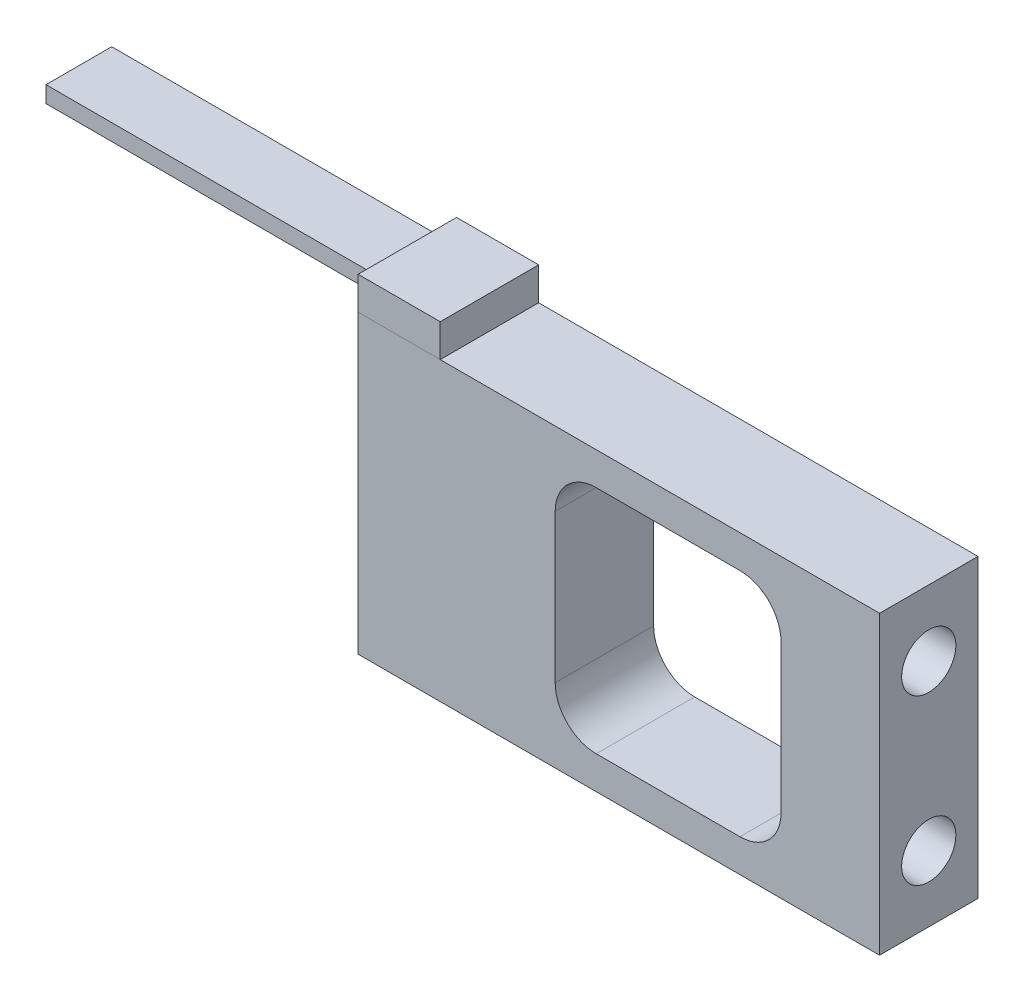
from build123d import *

# Parameters (mm, degrees)
SKETCH1_W                  = 31.75
SKETCH1_H                  = 18.034
BOSS_EXTRUDE1_DEPTH        = 2.9972
SKETCH8_W                  = 13.75
SKETCH8_H                  = 14.034
CUT_EXTRUDE3_DEPTH         = 20.216002325
FILLET1_R                  = 2.5
M4_TAPPED_HOLE1_AT_2_COUNT = 2
M4_TAPPED_HOLE1_AT_2_PITCH = 10
SKETCH6_W                  = 5
SKETCH6_H                  = 5.9944
BOSS_EXTRUDE2_DEPTH        = 2
SKETCH7_W                  = 4
SKETCH7_H                  = 1
BOSS_EXTRUDE3_DEPTH        = 20


with BuildPart() as part:
    # Sketch1 → Boss-Extrude1 (new, symmetric)
    with BuildSketch(Plane.XY):
        Rectangle(SKETCH1_W, SKETCH1_H)
    extrude(amount=BOSS_EXTRUDE1_DEPTH, both=True)

    # Sketch8 → Cut-Extrude3 (cut, through all)
    with BuildSketch(Plane.XY.offset(2.9972)):
        with Locations((3, 0)):
            Rectangle(SKETCH8_W, SKETCH8_H)
    extrude(amount=-CUT_EXTRUDE3_DEPTH, mode=Mode.SUBTRACT)

    # Fillet1
    fillet1_edges = [part.edges().sort_by_distance(p)[0] for p in [
        (-3.875, -7.017, 0),
        (-3.875, 7.017, 0),
        (9.875, 7.017, 0),
        (9.875, -7.017, 0),
    ]]
    fillet(fillet1_edges, radius=FILLET1_R)

    # Sketch3 → M4 Tapped Hole1 (revolve, cut)
    with BuildSketch(Plane(origin=(15.875, 5, 0), x_dir=(0, 0, -1), z_dir=(0, 1, 0))):
        Polygon((0, 0), (0, 10.491420021), (1.65, 9.5), (1.65, 0), align=None)
    m4_tapped_hole1 = revolve(axis=Axis((22.225, 5, 0), (-1, 0, 0)), mode=Mode.SUBTRACT)

    # M4 Tapped Hole1 at 2: M4 Tapped Hole1 ×2
    with Locations(*[(0, -i * M4_TAPPED_HOLE1_AT_2_PITCH, 0) for i in range(1, M4_TAPPED_HOLE1_AT_2_COUNT)]):
        add(m4_tapped_hole1, mode=Mode.SUBTRACT)

    # Mirror1: M4 Tapped Hole1 across plane
    add(m4_tapped_hole1.mirror(Plane(origin=(0, 0, 0), x_dir=(0, 0, 1), z_dir=(1, 0, 0))), mode=Mode.SUBTRACT)

    # Mirror1 copy 1 sketch → Mirror1 copy 1 (revolve, cut)
    with BuildSketch(Plane(origin=(-15.875, -5, 0), x_dir=(0, 0, -1), z_dir=(0, 1, 0))):
        Polygon((0, 0), (0, -10.491420021), (1.65, -9.5), (1.65, 0), align=None)
    revolve(axis=Axis((-22.225, -5, 0), (-1, 0, 0)), mode=Mode.SUBTRACT)


with BuildPart() as body_2:
    # Sketch6 → Boss-Extrude2 (new body)
    with BuildSketch(Plane(origin=(0, 9.017, 0), x_dir=(1, 0, 0), z_dir=(0, 1, 0))):
        with Locations((-13.375, 0)):
            Rectangle(SKETCH6_W, SKETCH6_H)
    extrude(amount=BOSS_EXTRUDE2_DEPTH)

    # Sketch7 → Boss-Extrude3 (add)
    with BuildSketch(Plane.ZY.offset(15.875)):
        with Locations((0, 10.017)):
            Rectangle(SKETCH7_W, SKETCH7_H)
    extrude(amount=BOSS_EXTRUDE3_DEPTH)


solid = Compound([part.part, body_2.part])
